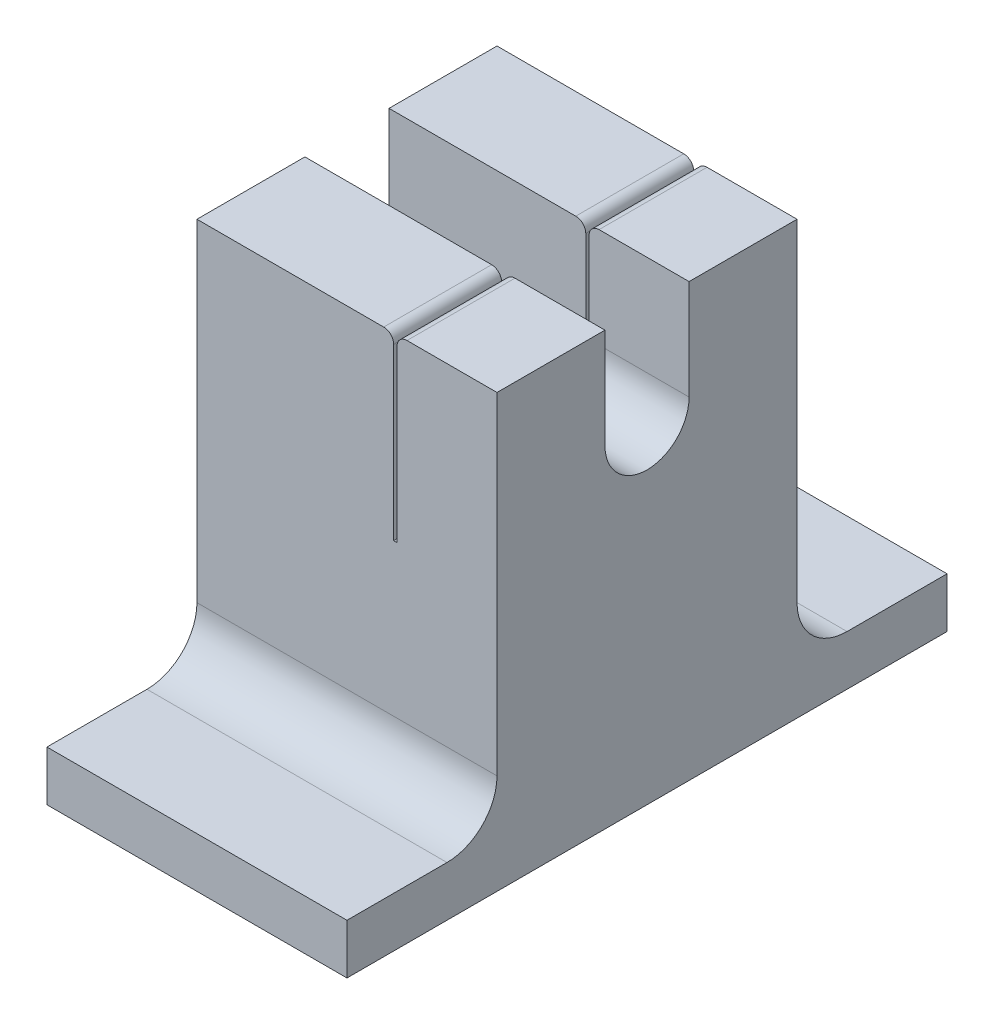
from build123d import *

# Parameters (mm, degrees)
SKETCH1_W           = 30
SKETCH1_H           = 30
BOSS_EXTRUDE1_DEPTH = 33.2
SKETCH2_R           = 4.205
CUT_EXTRUDE1_DEPTH  = 48.19364364
SKETCH4_W           = 60
SKETCH4_H           = 5
BOSS_EXTRUDE2_DEPTH = 30
FILLET1_R           = 5
SKETCH5_W           = 30
SKETCH5_H           = 10.795
BOSS_EXTRUDE3_DEPTH = 10
SKETCH6_W           = 0.33
SKETCH6_H           = 30
CUT_EXTRUDE2_DEPTH  = 18
FILLET2_R           = 1


with BuildPart() as part:
    # Sketch1 → Boss-Extrude1 (new body)
    with BuildSketch(Plane(origin=(0, 0, 0), x_dir=(1, 0, 0), z_dir=(0, 1, 0))):
        Rectangle(SKETCH1_W, SKETCH1_H)
    extrude(amount=BOSS_EXTRUDE1_DEPTH)

    # Sketch2 → Cut-Extrude1 (cut, through all)
    with BuildSketch(Plane.ZY.offset(15)):
        with Locations((0, 33.2)):
            Circle(SKETCH2_R)
    extrude(amount=-CUT_EXTRUDE1_DEPTH, mode=Mode.SUBTRACT)

    # Sketch4 → Boss-Extrude2 (add)
    with BuildSketch(Plane(origin=(15, 0, 0), x_dir=(0, 0, -1), z_dir=(1, 0, 0))):
        with Locations((0, 2.5)):
            Rectangle(SKETCH4_W, SKETCH4_H)
    extrude(amount=-BOSS_EXTRUDE2_DEPTH)

    # Fillet1
    fillet1_edges = [part.edges().sort_by_distance(p)[0] for p in [
        (0, 5, -15),
        (0, 5, 15),
    ]]
    fillet(fillet1_edges, radius=FILLET1_R)

    # Sketch5 → Boss-Extrude3 (add)
    with BuildSketch(Plane(origin=(0, 33.2, 0), x_dir=(1, 0, 0), z_dir=(0, 1, 0))):
        with Locations((0, 9.6025)):
            Rectangle(SKETCH5_W, SKETCH5_H)
        with Locations((0, -9.6025)):
            Rectangle(SKETCH5_W, SKETCH5_H)
    extrude(amount=BOSS_EXTRUDE3_DEPTH)

    # Sketch6 → Cut-Extrude2 (cut)
    with BuildSketch(Plane(origin=(0, 43.2, 0), x_dir=(1, 0, 0), z_dir=(0, 1, 0))):
        with Locations((4.835, 0)):
            Rectangle(SKETCH6_W, SKETCH6_H)
    extrude(amount=-CUT_EXTRUDE2_DEPTH, mode=Mode.SUBTRACT)

    # Fillet2
    fillet2_edges = [part.edges().sort_by_distance(p)[0] for p in [
        (5, 43.2, -9.6025),
        (5, 43.2, 9.6025),
        (4.67, 43.2, 9.6025),
        (4.67, 43.2, -9.6025),
    ]]
    fillet(fillet2_edges, radius=FILLET2_R)


solid = part.part
